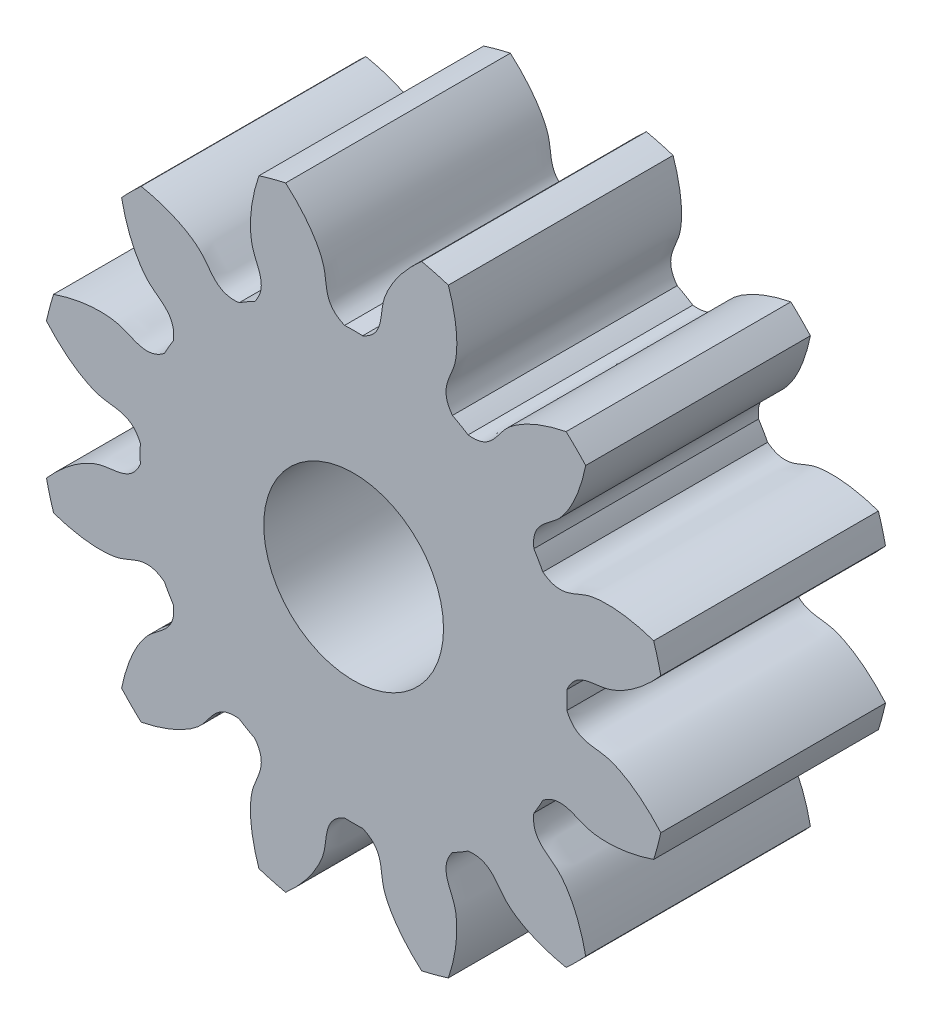
from build123d import *

# Parameters (mm, degrees)
SKETCH_1_R      = 2
EXTRUDE_1_DEPTH = 5


with BuildPart() as part:
    # 草图1 → 凸台-拉伸1 (new body)
    with BuildSketch(Plane.XY):
        with BuildLine():
            ThreePointArc((2.475254106, 14.212366042), (2.1762529, 14.139255283), (1.88075488, 14.053070454))
            add(Edge.make_bspline(
                [(1.789042792, 11.588136457), (2.102912939, 12.004394927), (1.812998898, 12.293709996), (1.72696164, 12.65075962), (1.718913835, 12.689405121), (1.709991472, 12.742801932), (1.702066143, 12.805462582), (1.695867153, 12.877378673), (1.692123046, 12.95849793), (1.691560675, 13.048724656), (1.694902528, 13.147919716), (1.702864502, 13.255900771), (1.716153576, 13.372442604), (1.739086531, 13.52068412), (1.776918382, 13.7033266), (1.827234211, 13.889388452), (1.865161105, 14.0073335), (1.88075488, 14.053070454)],
                knots=[0, 0, 0, 0, 0.218015236, 0.222043642, 0.231522246, 0.24289657, 0.256166614, 0.271332379, 0.288393865, 0.307351072, 0.328203999, 0.350952646, 0.375597015, 0.402137104, 0.445501713, 0.493131694, 0.523595567, 0.523595567, 0.523595567, 0.523595567], degree=3))
            ThreePointArc((1.789042792, 11.588136457), (1.612986215, 11.491395167), (1.441177512, 11.387296344))
            add(Edge.make_bspline(
                [(-0.739373992, 12.540338345), (-0.666523824, 12.525948688), (-0.545637309, 12.498685797), (-0.381308707, 12.453167141), (-0.248128748, 12.410478846), (-0.125235635, 12.365599865), (-0.012577993, 12.31927965), (0.089938864, 12.272259526), (0.182452296, 12.225270403), (0.265141646, 12.179030565), (0.33822743, 12.134243491), (0.401970411, 12.091595721), (0.456670583, 12.051754772), (0.502666081, 12.015367142), (0.535481366, 11.987217855), (0.557680955, 11.966933119), (0.81815485, 11.719336517), (0.923752029, 11.323606058), (1.441177512, 11.387296344)],
                knots=[0.476404433, 0.476404433, 0.476404433, 0.476404433, 0.523218896, 0.554498287, 0.583881957, 0.611369906, 0.636962134, 0.660658643, 0.68245943, 0.702364497, 0.720373843, 0.736487468, 0.750705373, 0.763027557, 0.773454021, 0.777956358, 0.781984764, 1, 1, 1, 1], degree=3))
            ThreePointArc((-0.739373992, 12.540338345), (-0.961761253, 12.327521967), (-1.174577631, 12.105134706))
            add(Edge.make_bspline(
                [(-0.02153563, 9.924583202), (0.042154656, 10.442008685), (-0.353575803, 10.547605864), (-0.606611066, 10.81380128), (-0.63290342, 10.843245363), (-0.667328819, 10.885027176), (-0.70552268, 10.935330226), (-0.746849209, 10.994511893), (-0.790651329, 11.062891176), (-0.83625172, 11.140748628), (-0.882955119, 11.228324997), (-0.930050376, 11.32582032), (-0.976812617, 11.433393046), (-1.031072853, 11.573240442), (-1.089630749, 11.750329394), (-1.139086888, 11.9366216), (-1.165213758, 12.057728454), (-1.174577631, 12.105134706)],
                knots=[0, 0, 0, 0, 0.218015236, 0.222043642, 0.231522246, 0.24289657, 0.256166614, 0.271332379, 0.288393865, 0.307351072, 0.328203999, 0.350952646, 0.375597015, 0.402137104, 0.445501713, 0.493131694, 0.523595567, 0.523595567, 0.523595567, 0.523595567], degree=3))
            ThreePointArc((-0.02153563, 9.924583202), (-0.125634453, 9.752774499), (-0.222375743, 9.576717922))
            add(Edge.make_bspline(
                [(-2.68730974, 9.485005834), (-2.617024816, 9.50896911), (-2.498702577, 9.545802011), (-2.333630505, 9.588546), (-2.19694913, 9.618166831), (-2.068081082, 9.64074705), (-1.947356594, 9.656961389), (-1.83506433, 9.667499195), (-1.731450787, 9.673062137), (-1.636719789, 9.674361938), (-1.551032107, 9.672118086), (-1.474505181, 9.667055523), (-1.407212967, 9.659902336), (-1.349185884, 9.651387473), (-1.306692369, 9.643417117), (-1.277324593, 9.636949816), (-0.927949282, 9.552761816), (-0.638634213, 9.262847775), (-0.222375743, 9.576717922)],
                knots=[0.476404433, 0.476404433, 0.476404433, 0.476404433, 0.523218896, 0.554498287, 0.583881957, 0.611369906, 0.636962134, 0.660658643, 0.68245943, 0.702364497, 0.720373843, 0.736487468, 0.750705373, 0.763027557, 0.773454021, 0.777956358, 0.781984764, 1, 1, 1, 1], degree=3))
            ThreePointArc((-2.68730974, 9.485005834), (-2.773494569, 9.189507814), (-2.846605328, 8.890506608))
            add(Edge.make_bspline(
                [(-0.757765911, 7.578614611), (-0.961321247, 8.058563368), (-1.356832467, 7.952147977), (-1.709065141, 8.056162339), (-1.74655703, 8.068515485), (-1.797261206, 8.087486897), (-1.855489585, 8.111953686), (-1.920870242, 8.142543249), (-1.992993632, 8.179860385), (-2.071413455, 8.224486721), (-2.15564797, 8.276978381), (-2.24518132, 8.33786418), (-2.339464971, 8.407643772), (-2.456379413, 8.501625052), (-2.595636514, 8.625709636), (-2.73161289, 8.762315348), (-2.81479285, 8.854133526), (-2.846605328, 8.890506608)],
                knots=[0, 0, 0, 0, 0.218015236, 0.222043642, 0.231522246, 0.24289657, 0.256166614, 0.271332379, 0.288393865, 0.307351072, 0.328203999, 0.350952646, 0.375597015, 0.402137104, 0.445501713, 0.493131694, 0.523595567, 0.523595567, 0.523595567, 0.523595567], degree=3))
            ThreePointArc((-0.757765911, 7.578614611), (-0.762013785, 7.377774499), (-0.757765911, 7.176934386))
            add(Edge.make_bspline(
                [(-2.846605328, 5.865042389), (-2.797718436, 5.920937657), (-2.713664822, 6.011997004), (-2.592080208, 6.13155042), (-2.488521081, 6.2255435), (-2.388208187, 6.309532568), (-2.291764883, 6.383936841), (-2.199785833, 6.449208981), (-2.112835343, 6.505833401), (-2.031445793, 6.554324561), (-1.956116157, 6.595225169), (-1.887310614, 6.629104324), (-1.825457254, 6.656555589), (-1.770946894, 6.678195043), (-1.730161253, 6.69253927), (-1.701494362, 6.701622311), (-1.356832467, 6.80340102), (-0.961321247, 6.696985629), (-0.757765911, 7.176934386)],
                knots=[0.476404433, 0.476404433, 0.476404433, 0.476404433, 0.523218896, 0.554498287, 0.583881957, 0.611369906, 0.636962134, 0.660658643, 0.68245943, 0.702364497, 0.720373843, 0.736487468, 0.750705373, 0.763027557, 0.773454021, 0.777956358, 0.781984764, 1, 1, 1, 1], degree=3))
            ThreePointArc((-2.846605328, 5.865042389), (-2.773494569, 5.566041183), (-2.68730974, 5.270543163))
            add(Edge.make_bspline(
                [(-0.222375743, 5.178831075), (-0.638634213, 5.492701222), (-0.927949282, 5.202787181), (-1.284998906, 5.116749923), (-1.323644407, 5.108702118), (-1.377041218, 5.099779755), (-1.439701868, 5.091854426), (-1.511617959, 5.085655436), (-1.592737216, 5.081911329), (-1.682963942, 5.081348958), (-1.782159002, 5.084690811), (-1.890140057, 5.092652785), (-2.00668189, 5.105941859), (-2.154923406, 5.128874814), (-2.337565886, 5.166706665), (-2.523627738, 5.217022494), (-2.641572786, 5.254949389), (-2.68730974, 5.270543163)],
                knots=[0, 0, 0, 0, 0.218015236, 0.222043642, 0.231522246, 0.24289657, 0.256166614, 0.271332379, 0.288393865, 0.307351072, 0.328203999, 0.350952646, 0.375597015, 0.402137104, 0.445501713, 0.493131694, 0.523595567, 0.523595567, 0.523595567, 0.523595567], degree=3))
            ThreePointArc((-0.222375743, 5.178831075), (-0.125634453, 5.002774499), (-0.02153563, 4.830965795))
            add(Edge.make_bspline(
                [(-1.174577631, 2.650414291), (-1.160187974, 2.723264459), (-1.132925083, 2.844150974), (-1.087406427, 3.008479576), (-1.044718132, 3.141659535), (-0.999839151, 3.264552648), (-0.953518937, 3.377210291), (-0.906498812, 3.479727147), (-0.859509689, 3.572240579), (-0.813269851, 3.65492993), (-0.768482777, 3.728015713), (-0.725835007, 3.791758694), (-0.685994058, 3.846458867), (-0.649606428, 3.892454364), (-0.621457141, 3.925269649), (-0.601172405, 3.947469238), (-0.353575803, 4.207943133), (0.042154656, 4.313540312), (-0.02153563, 4.830965795)],
                knots=[0.476404433, 0.476404433, 0.476404433, 0.476404433, 0.523218896, 0.554498287, 0.583881957, 0.611369906, 0.636962134, 0.660658643, 0.68245943, 0.702364497, 0.720373843, 0.736487468, 0.750705373, 0.763027557, 0.773454021, 0.777956358, 0.781984764, 1, 1, 1, 1], degree=3))
            ThreePointArc((-1.174577631, 2.650414291), (-0.961761253, 2.42802703), (-0.739373992, 2.215210652))
            add(Edge.make_bspline(
                [(1.441177512, 3.368252653), (0.923752029, 3.431942939), (0.81815485, 3.03621248), (0.551959434, 2.783177217), (0.522515351, 2.756884863), (0.480733538, 2.722459464), (0.430430488, 2.684265603), (0.371248821, 2.642939074), (0.302869538, 2.599136954), (0.225012086, 2.553536563), (0.137435717, 2.506833164), (0.039940394, 2.459737908), (-0.067632332, 2.412975667), (-0.207479728, 2.35871543), (-0.38456868, 2.300157534), (-0.570860886, 2.250701395), (-0.69196774, 2.224574525), (-0.739373992, 2.215210652)],
                knots=[0, 0, 0, 0, 0.218015236, 0.222043642, 0.231522246, 0.24289657, 0.256166614, 0.271332379, 0.288393865, 0.307351072, 0.328203999, 0.350952646, 0.375597015, 0.402137104, 0.445501713, 0.493131694, 0.523595567, 0.523595567, 0.523595567, 0.523595567], degree=3))
            ThreePointArc((1.441177512, 3.368252653), (1.612986215, 3.264153831), (1.789042792, 3.16741254))
            add(Edge.make_bspline(
                [(1.88075488, 0.702478543), (1.856791604, 0.772763467), (1.819958703, 0.891085706), (1.777214714, 1.056157778), (1.747593882, 1.192839153), (1.725013664, 1.321707201), (1.708799325, 1.442431689), (1.698261519, 1.554723953), (1.692698577, 1.658337497), (1.691398776, 1.753068494), (1.693642628, 1.838756176), (1.698705191, 1.915283102), (1.705858378, 1.982575316), (1.714373241, 2.0406024), (1.722343596, 2.083095914), (1.728810898, 2.11246369), (1.812998898, 2.461839001), (2.102912939, 2.75115407), (1.789042792, 3.16741254)],
                knots=[0.476404433, 0.476404433, 0.476404433, 0.476404433, 0.523218896, 0.554498287, 0.583881957, 0.611369906, 0.636962134, 0.660658643, 0.68245943, 0.702364497, 0.720373843, 0.736487468, 0.750705373, 0.763027557, 0.773454021, 0.777956358, 0.781984764, 1, 1, 1, 1], degree=3))
            ThreePointArc((1.88075488, 0.702478543), (2.1762529, 0.616293715), (2.475254106, 0.543182955))
            add(Edge.make_bspline(
                [(3.787146103, 2.632022372), (3.307197346, 2.428467036), (3.413612737, 2.032955816), (3.309598375, 1.680723142), (3.297245229, 1.643231254), (3.278273817, 1.592527077), (3.253807028, 1.534298698), (3.223217465, 1.468918041), (3.185900329, 1.396794651), (3.141273993, 1.318374828), (3.088782333, 1.234140313), (3.027896534, 1.144606963), (2.958116942, 1.050323312), (2.864135662, 0.93340887), (2.740051078, 0.794151769), (2.603445365, 0.658175393), (2.511627188, 0.574995433), (2.475254106, 0.543182955)],
                knots=[0, 0, 0, 0, 0.218015236, 0.222043642, 0.231522246, 0.24289657, 0.256166614, 0.271332379, 0.288393865, 0.307351072, 0.328203999, 0.350952646, 0.375597015, 0.402137104, 0.445501713, 0.493131694, 0.523595567, 0.523595567, 0.523595567, 0.523595567], degree=3))
            ThreePointArc((3.787146103, 2.632022372), (3.987986215, 2.627774499), (4.188826328, 2.632022372))
            add(Edge.make_bspline(
                [(5.500718325, 0.543182955), (5.444823057, 0.592069847), (5.35376371, 0.676123461), (5.234210294, 0.797708075), (5.140217214, 0.901267202), (5.056228146, 1.001580096), (4.981823873, 1.0980234), (4.916551733, 1.19000245), (4.859927313, 1.27695294), (4.811436153, 1.35834249), (4.770535545, 1.433672126), (4.73665639, 1.502477669), (4.709205125, 1.564331029), (4.687565671, 1.618841389), (4.673221444, 1.65962703), (4.664138403, 1.688293921), (4.562359694, 2.032955816), (4.668775085, 2.428467036), (4.188826328, 2.632022372)],
                knots=[0.476404433, 0.476404433, 0.476404433, 0.476404433, 0.523218896, 0.554498287, 0.583881957, 0.611369906, 0.636962134, 0.660658643, 0.68245943, 0.702364497, 0.720373843, 0.736487468, 0.750705373, 0.763027557, 0.773454021, 0.777956358, 0.781984764, 1, 1, 1, 1], degree=3))
            ThreePointArc((5.500718325, 0.543182955), (5.799719531, 0.616293715), (6.095217551, 0.702478543))
            add(Edge.make_bspline(
                [(6.186929639, 3.16741254), (5.873059492, 2.75115407), (6.162973533, 2.461839001), (6.249010791, 2.104789377), (6.257058596, 2.066143876), (6.265980959, 2.012747065), (6.273906288, 1.950086415), (6.280105278, 1.878170324), (6.283849385, 1.797051068), (6.284411756, 1.706824341), (6.281069903, 1.607629281), (6.273107929, 1.499648226), (6.259818855, 1.383106393), (6.2368859, 1.234864877), (6.199054049, 1.052222397), (6.148738219, 0.866160545), (6.110811325, 0.748215498), (6.095217551, 0.702478543)],
                knots=[0, 0, 0, 0, 0.218015236, 0.222043642, 0.231522246, 0.24289657, 0.256166614, 0.271332379, 0.288393865, 0.307351072, 0.328203999, 0.350952646, 0.375597015, 0.402137104, 0.445501713, 0.493131694, 0.523595567, 0.523595567, 0.523595567, 0.523595567], degree=3))
            ThreePointArc((6.186929639, 3.16741254), (6.362986215, 3.264153831), (6.534794918, 3.368252653))
            add(Edge.make_bspline(
                [(8.715346423, 2.215210652), (8.642496255, 2.229600309), (8.52160974, 2.2568632), (8.357281138, 2.302381856), (8.224101179, 2.345070151), (8.101208066, 2.389949132), (7.988550423, 2.436269347), (7.886033567, 2.483289471), (7.793520135, 2.530278594), (7.710830784, 2.576518432), (7.637745001, 2.621305506), (7.57400202, 2.663953276), (7.519301847, 2.703794226), (7.47330635, 2.740181855), (7.440491065, 2.768331143), (7.418291476, 2.788615878), (7.157817581, 3.03621248), (7.052220402, 3.431942939), (6.534794918, 3.368252653)],
                knots=[0.476404433, 0.476404433, 0.476404433, 0.476404433, 0.523218896, 0.554498287, 0.583881957, 0.611369906, 0.636962134, 0.660658643, 0.68245943, 0.702364497, 0.720373843, 0.736487468, 0.750705373, 0.763027557, 0.773454021, 0.777956358, 0.781984764, 1, 1, 1, 1], degree=3))
            ThreePointArc((8.715346423, 2.215210652), (8.937733684, 2.42802703), (9.150550062, 2.650414291))
            add(Edge.make_bspline(
                [(7.997508061, 4.830965795), (7.933817775, 4.313540312), (8.329548234, 4.207943133), (8.582583497, 3.941747717), (8.608875851, 3.912303634), (8.64330125, 3.870521821), (8.681495111, 3.820218771), (8.72282164, 3.761037104), (8.76662376, 3.692657821), (8.81222415, 3.614800369), (8.85892755, 3.527224), (8.906022806, 3.429728677), (8.952785047, 3.322155951), (9.007045284, 3.182308555), (9.06560318, 3.005219603), (9.115059319, 2.818927397), (9.141186189, 2.697820543), (9.150550062, 2.650414291)],
                knots=[0, 0, 0, 0, 0.218015236, 0.222043642, 0.231522246, 0.24289657, 0.256166614, 0.271332379, 0.288393865, 0.307351072, 0.328203999, 0.350952646, 0.375597015, 0.402137104, 0.445501713, 0.493131694, 0.523595567, 0.523595567, 0.523595567, 0.523595567], degree=3))
            ThreePointArc((7.997508061, 4.830965795), (8.101606883, 5.002774499), (8.198348174, 5.178831075))
            add(Edge.make_bspline(
                [(10.663282171, 5.270543163), (10.592997247, 5.246579887), (10.474675008, 5.209746986), (10.309602936, 5.167002998), (10.172921561, 5.137382166), (10.044053513, 5.114801947), (9.923329025, 5.098587608), (9.811036761, 5.088049802), (9.707423217, 5.08248686), (9.61269222, 5.081187059), (9.527004538, 5.083430911), (9.450477612, 5.088493474), (9.383185398, 5.095646661), (9.325158314, 5.104161524), (9.2826648, 5.11213188), (9.253297024, 5.118599181), (8.903921713, 5.202787181), (8.614606644, 5.492701222), (8.198348174, 5.178831075)],
                knots=[0.476404433, 0.476404433, 0.476404433, 0.476404433, 0.523218896, 0.554498287, 0.583881957, 0.611369906, 0.636962134, 0.660658643, 0.68245943, 0.702364497, 0.720373843, 0.736487468, 0.750705373, 0.763027557, 0.773454021, 0.777956358, 0.781984764, 1, 1, 1, 1], degree=3))
            ThreePointArc((10.663282171, 5.270543163), (10.749466999, 5.566041183), (10.822577759, 5.865042389))
            add(Edge.make_bspline(
                [(8.733738342, 7.176934386), (8.937293678, 6.696985629), (9.332804898, 6.80340102), (9.685037572, 6.699386658), (9.72252946, 6.687033512), (9.773233636, 6.6680621), (9.831462016, 6.643595311), (9.896842673, 6.613005748), (9.968966063, 6.575688612), (10.047385886, 6.531062276), (10.131620401, 6.478570616), (10.221153751, 6.417684817), (10.315437402, 6.347905225), (10.432351843, 6.253923945), (10.571608945, 6.129839361), (10.707585321, 5.993233649), (10.790765281, 5.901415471), (10.822577759, 5.865042389)],
                knots=[0, 0, 0, 0, 0.218015236, 0.222043642, 0.231522246, 0.24289657, 0.256166614, 0.271332379, 0.288393865, 0.307351072, 0.328203999, 0.350952646, 0.375597015, 0.402137104, 0.445501713, 0.493131694, 0.523595567, 0.523595567, 0.523595567, 0.523595567], degree=3))
            ThreePointArc((8.733738342, 7.176934386), (8.737986215, 7.377774499), (8.733738342, 7.578614611))
            add(Edge.make_bspline(
                [(10.822577759, 8.890506608), (10.773690867, 8.83461134), (10.689637253, 8.743551993), (10.568052639, 8.623998577), (10.464493512, 8.530005497), (10.364180618, 8.446016429), (10.267737314, 8.371612156), (10.175758264, 8.306340016), (10.088807774, 8.249715596), (10.007418224, 8.201224436), (9.932088588, 8.160323828), (9.863283045, 8.126444673), (9.801429685, 8.098993408), (9.746919325, 8.077353954), (9.706133684, 8.063009727), (9.677466793, 8.053926686), (9.332804898, 7.952147977), (8.937293678, 8.058563368), (8.733738342, 7.578614611)],
                knots=[0.476404433, 0.476404433, 0.476404433, 0.476404433, 0.523218896, 0.554498287, 0.583881957, 0.611369906, 0.636962134, 0.660658643, 0.68245943, 0.702364497, 0.720373843, 0.736487468, 0.750705373, 0.763027557, 0.773454021, 0.777956358, 0.781984764, 1, 1, 1, 1], degree=3))
            ThreePointArc((10.822577759, 8.890506608), (10.749466999, 9.189507814), (10.663282171, 9.485005834))
            add(Edge.make_bspline(
                [(8.198348174, 9.576717922), (8.614606644, 9.262847775), (8.903921713, 9.552761816), (9.260971337, 9.638799074), (9.299616838, 9.646846879), (9.353013649, 9.655769242), (9.415674299, 9.663694571), (9.48759039, 9.669893561), (9.568709646, 9.673637668), (9.658936373, 9.674200039), (9.758131433, 9.670858186), (9.866112488, 9.662896212), (9.982654321, 9.649607138), (10.130895837, 9.626674183), (10.313538317, 9.588842332), (10.499600169, 9.538526503), (10.617545216, 9.500599608), (10.663282171, 9.485005834)],
                knots=[0, 0, 0, 0, 0.218015236, 0.222043642, 0.231522246, 0.24289657, 0.256166614, 0.271332379, 0.288393865, 0.307351072, 0.328203999, 0.350952646, 0.375597015, 0.402137104, 0.445501713, 0.493131694, 0.523595567, 0.523595567, 0.523595567, 0.523595567], degree=3))
            ThreePointArc((8.198348174, 9.576717922), (8.101606883, 9.752774499), (7.997508061, 9.924583202))
            add(Edge.make_bspline(
                [(9.150550062, 12.105134706), (9.136160405, 12.032284538), (9.108897514, 11.911398023), (9.063378858, 11.747069421), (9.020690563, 11.613889462), (8.975811582, 11.490996349), (8.929491367, 11.378338707), (8.882471243, 11.27582185), (8.83548212, 11.183308418), (8.789242282, 11.100619068), (8.744455208, 11.027533284), (8.701807437, 10.963790303), (8.661966488, 10.909090131), (8.625578859, 10.863094633), (8.597429571, 10.830279348), (8.577144836, 10.808079759), (8.329548234, 10.547605864), (7.933817775, 10.442008685), (7.997508061, 9.924583202)],
                knots=[0.476404433, 0.476404433, 0.476404433, 0.476404433, 0.523218896, 0.554498287, 0.583881957, 0.611369906, 0.636962134, 0.660658643, 0.68245943, 0.702364497, 0.720373843, 0.736487468, 0.750705373, 0.763027557, 0.773454021, 0.777956358, 0.781984764, 1, 1, 1, 1], degree=3))
            ThreePointArc((9.150550062, 12.105134706), (8.937733684, 12.327521967), (8.715346423, 12.540338345))
            add(Edge.make_bspline(
                [(6.534794918, 11.387296344), (7.052220402, 11.323606058), (7.157817581, 11.719336517), (7.424012997, 11.97237178), (7.45345708, 11.998664134), (7.495238893, 12.033089533), (7.545541943, 12.071283394), (7.60472361, 12.112609923), (7.673102893, 12.156412043), (7.750960345, 12.202012434), (7.838536714, 12.248715833), (7.936032037, 12.295811089), (8.043604763, 12.34257333), (8.183452159, 12.396833567), (8.360541111, 12.455391463), (8.546833317, 12.504847602), (8.667940171, 12.530974472), (8.715346423, 12.540338345)],
                knots=[0, 0, 0, 0, 0.218015236, 0.222043642, 0.231522246, 0.24289657, 0.256166614, 0.271332379, 0.288393865, 0.307351072, 0.328203999, 0.350952646, 0.375597015, 0.402137104, 0.445501713, 0.493131694, 0.523595567, 0.523595567, 0.523595567, 0.523595567], degree=3))
            ThreePointArc((6.534794918, 11.387296344), (6.362986215, 11.491395167), (6.186929639, 11.588136457))
            add(Edge.make_bspline(
                [(6.095217551, 14.053070454), (6.119180827, 13.98278553), (6.156013728, 13.864463291), (6.198757716, 13.699391219), (6.228378548, 13.562709844), (6.250958767, 13.433841796), (6.267173106, 13.313117308), (6.277710912, 13.200825044), (6.283273854, 13.0972115), (6.284573655, 13.002480503), (6.282329803, 12.916792821), (6.27726724, 12.840265895), (6.270114053, 12.772973681), (6.26159919, 12.714946597), (6.253628834, 12.672453083), (6.247161533, 12.643085307), (6.162973533, 12.293709996), (5.873059492, 12.004394927), (6.186929639, 11.588136457)],
                knots=[0.476404433, 0.476404433, 0.476404433, 0.476404433, 0.523218896, 0.554498287, 0.583881957, 0.611369906, 0.636962134, 0.660658643, 0.68245943, 0.702364497, 0.720373843, 0.736487468, 0.750705373, 0.763027557, 0.773454021, 0.777956358, 0.781984764, 1, 1, 1, 1], degree=3))
            ThreePointArc((6.095217551, 14.053070454), (5.799719531, 14.139255283), (5.500718325, 14.212366042))
            add(Edge.make_bspline(
                [(4.188826328, 12.123526625), (4.668775085, 12.327081961), (4.562359694, 12.722593181), (4.666374055, 13.074825855), (4.678727202, 13.112317744), (4.697698614, 13.16302192), (4.722165403, 13.221250299), (4.752754966, 13.286630956), (4.790072102, 13.358754346), (4.834698438, 13.437174169), (4.887190098, 13.521408684), (4.948075897, 13.610942034), (5.017855489, 13.705225685), (5.111836769, 13.822140127), (5.235921352, 13.961397228), (5.372527065, 14.097373604), (5.464345243, 14.180553564), (5.500718325, 14.212366042)],
                knots=[0, 0, 0, 0, 0.218015236, 0.222043642, 0.231522246, 0.24289657, 0.256166614, 0.271332379, 0.288393865, 0.307351072, 0.328203999, 0.350952646, 0.375597015, 0.402137104, 0.445501713, 0.493131694, 0.523595567, 0.523595567, 0.523595567, 0.523595567], degree=3))
            ThreePointArc((4.188826328, 12.123526625), (3.987986215, 12.127774499), (3.787146103, 12.123526625))
            add(Edge.make_bspline(
                [(2.475254106, 14.212366042), (2.531149373, 14.16347915), (2.622208721, 14.079425536), (2.741762137, 13.957840922), (2.835755217, 13.854281795), (2.919744284, 13.753968901), (2.994148558, 13.657525597), (3.059420698, 13.565546547), (3.116045118, 13.478596057), (3.164536278, 13.397206507), (3.205436886, 13.321876871), (3.239316041, 13.253071328), (3.266767306, 13.191217968), (3.28840676, 13.136707608), (3.302750987, 13.095921967), (3.311834028, 13.067255076), (3.413612737, 12.722593181), (3.307197346, 12.327081961), (3.787146103, 12.123526625)],
                knots=[0.476404433, 0.476404433, 0.476404433, 0.476404433, 0.523218896, 0.554498287, 0.583881957, 0.611369906, 0.636962134, 0.660658643, 0.68245943, 0.702364497, 0.720373843, 0.736487468, 0.750705373, 0.763027557, 0.773454021, 0.777956358, 0.781984764, 1, 1, 1, 1], degree=3))
        make_face()
        with Locations((3.987986215, 7.377774499)):
            Circle(SKETCH_1_R, mode=Mode.SUBTRACT)
    extrude(amount=EXTRUDE_1_DEPTH)


solid = part.part
